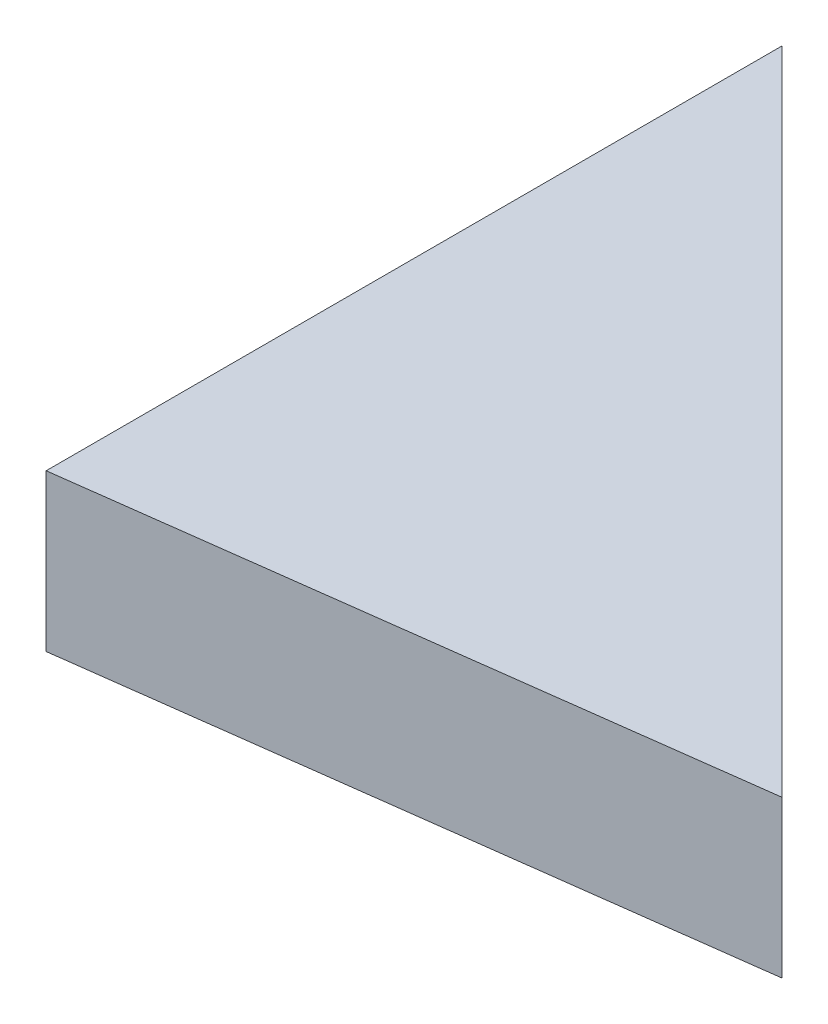
from build123d import *

# Parameters (mm, degrees)
BOSS_EXTRUDE1_DEPTH = 3.175


with BuildPart() as part:
    # Sketch2 → Boss-Extrude1 (new body)
    with BuildSketch(Plane(origin=(0, 0, 0), x_dir=(1, 0, 0), z_dir=(0, 1, 0))):
        Polygon((52.403782418, -8.654260267), (52.403782418, -23.571199953), (65.594650002, -21.845127851), align=None)
    extrude(amount=BOSS_EXTRUDE1_DEPTH)


solid = part.part
